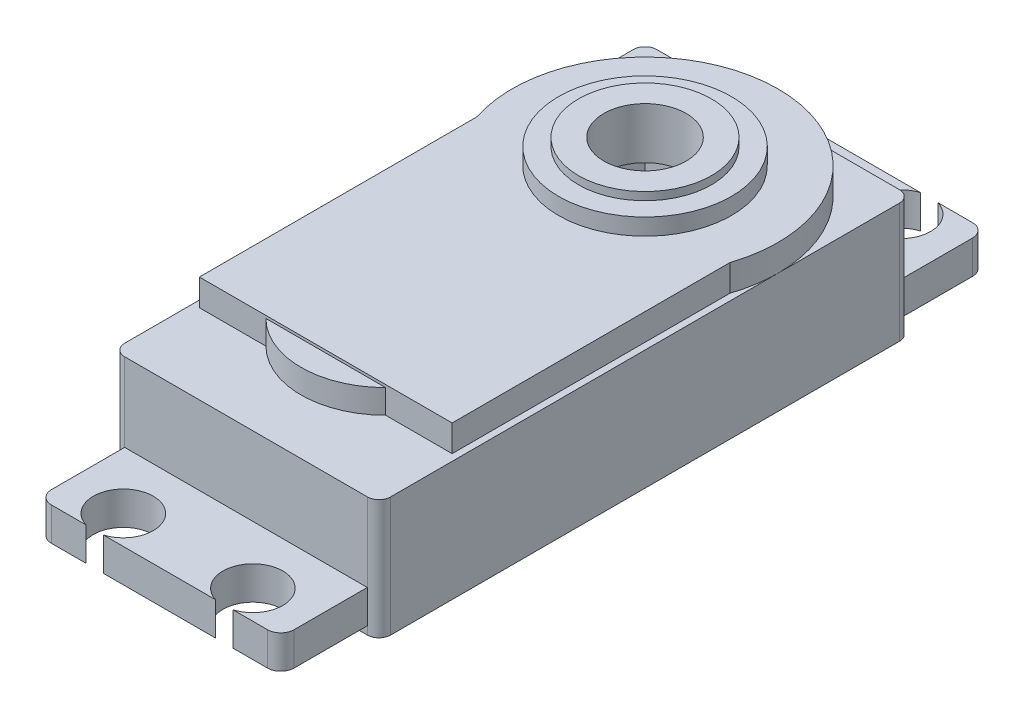
from build123d import *

# Parameters (mm, degrees)
BOSS_EXTRUDE1_DEPTH     = 9
SHELL1_T                = -1
BOSS_EXTRUDE2_DEPTH     = 2
SKETCH3_R               = 6.5
BOSS_EXTRUDE3_DEPTH     = 1.25
SKETCH4_R               = 5
BOSS_EXTRUDE4_DEPTH     = 0.6
CUT_EXTRUDE1_DEPTH      = 26.78996898
CUT_EXTRUDE1_DEPTH_BACK = 26.78996898
SKETCH5_R               = 3.1
BOSS_EXTRUDE5_DEPTH     = 1.8
SKETCH7_W               = 18.24
SKETCH7_H               = 6.5
BOSS_EXTRUDE6_DEPTH     = 2.5
CUT_EXTRUDE2_REACH      = 31.955
SKETCH8_R               = 2.25
FILLET2_R               = 1
CUT_EXTRUDE3_DEPTH      = 30.432125306
CUT_EXTRUDE3_DEPTH_BACK = 1
SKETCH9_R               = 9


with BuildPart() as part:
    # Sketch1 → Boss-Extrude1 (new body)
    with BuildSketch(Plane(origin=(0, 0, 0), x_dir=(1, 0, 0), z_dir=(0, 1, 0))):
        with BuildLine():
            Line((-9.12, 20), (9.12, 20))
            ThreePointArc((9.12, 20), (9.742253967, 19.742253967), (10, 19.12))
            Line((10, 19.12), (10, -19.12))
            ThreePointArc((10, -19.12), (9.742253967, -19.742253967), (9.12, -20))
            Line((9.12, -20), (-9.12, -20))
            ThreePointArc((-9.12, -20), (-9.742253967, -19.742253967), (-10, -19.12))
            Line((-10, -19.12), (-10, 19.12))
            ThreePointArc((-10, 19.12), (-9.742253967, 19.742253967), (-9.12, 20))
        make_face()
    extrude(amount=BOSS_EXTRUDE1_DEPTH)

    # Shell1
    shell1_openings = [part.faces().sort_by_distance(p)[0] for p in [
        (0, 0, 0),
    ]]
    offset(amount=SHELL1_T, openings=shell1_openings, kind=Kind.INTERSECTION)

    # Sketch2 → Boss-Extrude2 (add)
    with BuildSketch(Plane(origin=(0, 9, 0), x_dir=(1, 0, 0), z_dir=(0, 1, 0))):
        with BuildLine():
            Line((9.5, -14), (-9.5, -14))
            Line((-9.5, -14), (-9.5, 6.877501001))
            ThreePointArc((-9.5, 6.877501001), (0, 20), (9.5, 6.877501001))
            Line((9.5, 6.877501001), (9.5, -14))
        make_face()
    extrude(amount=BOSS_EXTRUDE2_DEPTH)

    # Sketch3 → Boss-Extrude3 (add)
    with BuildSketch(Plane(origin=(0, 11, 0), x_dir=(1, 0, 0), z_dir=(0, 1, 0))):
        with Locations(Location((0, 10, 0), (0, 0, 270))):
            Circle(SKETCH3_R)
    extrude(amount=BOSS_EXTRUDE3_DEPTH)

    # Sketch4 → Boss-Extrude4 (add)
    with BuildSketch(Plane(origin=(0, 12.25, 0), x_dir=(1, 0, 0), z_dir=(0, 1, 0))):
        with Locations(Location((0, 10, 0), (0, 0, 270))):
            Circle(SKETCH4_R)
    extrude(amount=BOSS_EXTRUDE4_DEPTH)

    # Sketch5 → Cut-Extrude1 (cut, two sides: drawn at the far end of the back side and taken through both)
    with BuildSketch(Plane(origin=(0, 12.85, 0), x_dir=(1, 0, 0), z_dir=(0, 1, 0)).offset(-CUT_EXTRUDE1_DEPTH_BACK)):
        with Locations(Location((0, 10, 0), (0, 0, 270))):
            Circle(SKETCH5_R)
    extrude(amount=CUT_EXTRUDE1_DEPTH + CUT_EXTRUDE1_DEPTH_BACK, mode=Mode.SUBTRACT)

    # Sketch6 → Boss-Extrude5 (add)
    with BuildSketch(Plane(origin=(0, 9, 0), x_dir=(1, 0, 0), z_dir=(0, 1, 0))):
        with BuildLine():
            Line((-4.5, -14), (4.5, -14))
            ThreePointArc((4.5, -14), (0, -15.863961031), (-4.5, -14))
        make_face()
    extrude(amount=BOSS_EXTRUDE5_DEPTH)

    # Sketch7 → Boss-Extrude6 (add)
    with BuildSketch(Plane(origin=(0, 0.6, 0), x_dir=(1, 0, 0), z_dir=(0, 1, 0))):
        with Locations((0, 23.25)):
            Rectangle(SKETCH7_W, SKETCH7_H)
        with Locations((0, -23.25)):
            Rectangle(SKETCH7_W, SKETCH7_H)
    extrude(amount=BOSS_EXTRUDE6_DEPTH)

    # Sketch8 → Cut-Extrude2 (cut, up to next)
    with BuildSketch(Plane(origin=(0, 3.1, 0), x_dir=(1, 0, 0), z_dir=(0, 1, 0)), mode=Mode.PRIVATE) as cut_extrude2_sk1:
        with Locations((-4.87, 24.35)):
            Circle(SKETCH8_R)
    cut_extrude2_tool1 = extrude(cut_extrude2_sk1.sketch, amount=-CUT_EXTRUDE2_REACH, mode=Mode.PRIVATE) & part.part
    # Sketch8 → Cut-Extrude2 (cut, up to next)
    with BuildSketch(Plane(origin=(0, 3.1, 0), x_dir=(1, 0, 0), z_dir=(0, 1, 0)), mode=Mode.PRIVATE) as cut_extrude2_sk2:
        with Locations((4.87, 24.35)):
            Circle(SKETCH8_R)
    cut_extrude2_tool2 = extrude(cut_extrude2_sk2.sketch, amount=-CUT_EXTRUDE2_REACH, mode=Mode.PRIVATE) & part.part
    # Sketch8 → Cut-Extrude2 (cut, up to next)
    with BuildSketch(Plane(origin=(0, 3.1, 0), x_dir=(1, 0, 0), z_dir=(0, 1, 0)), mode=Mode.PRIVATE) as cut_extrude2_sk3:
        with Locations((-4.87, -24.35)):
            Circle(SKETCH8_R)
    cut_extrude2_tool3 = extrude(cut_extrude2_sk3.sketch, amount=-CUT_EXTRUDE2_REACH, mode=Mode.PRIVATE) & part.part
    # Sketch8 → Cut-Extrude2 (cut, up to next)
    with BuildSketch(Plane(origin=(0, 3.1, 0), x_dir=(1, 0, 0), z_dir=(0, 1, 0)), mode=Mode.PRIVATE) as cut_extrude2_sk4:
        with Locations((4.87, -24.35)):
            Circle(SKETCH8_R)
    cut_extrude2_tool4 = extrude(cut_extrude2_sk4.sketch, amount=-CUT_EXTRUDE2_REACH, mode=Mode.PRIVATE) & part.part
    add(cut_extrude2_tool1.solids().sort_by_distance((-4.87, 3.1, -24.35))[0], mode=Mode.SUBTRACT)
    add(cut_extrude2_tool2.solids().sort_by_distance((4.87, 3.1, -24.35))[0], mode=Mode.SUBTRACT)
    add(cut_extrude2_tool3.solids().sort_by_distance((-4.87, 3.1, 24.35))[0], mode=Mode.SUBTRACT)
    add(cut_extrude2_tool4.solids().sort_by_distance((4.87, 3.1, 24.35))[0], mode=Mode.SUBTRACT)

    # Fillet2
    fillet2_edges = [part.edges().sort_by_distance(p)[0] for p in [
        (9.12, 1.85, -26.5),
        (-9.12, 1.85, -26.5),
        (-9.12, 1.85, 26.5),
        (9.12, 1.85, 26.5),
    ]]
    fillet(fillet2_edges, radius=FILLET2_R)

    # Sketch9 → Cut-Extrude3 (cut, two sides: drawn at the far end of the back side and taken through both)
    with BuildSketch(Plane.XZ.offset(-8).offset(-CUT_EXTRUDE3_DEPTH_BACK)):
        with Locations(Location((0, -10, 0), (0, 0, 270))):
            Circle(SKETCH9_R)
    extrude(amount=CUT_EXTRUDE3_DEPTH + CUT_EXTRUDE3_DEPTH_BACK, mode=Mode.SUBTRACT)


solid = part.part
